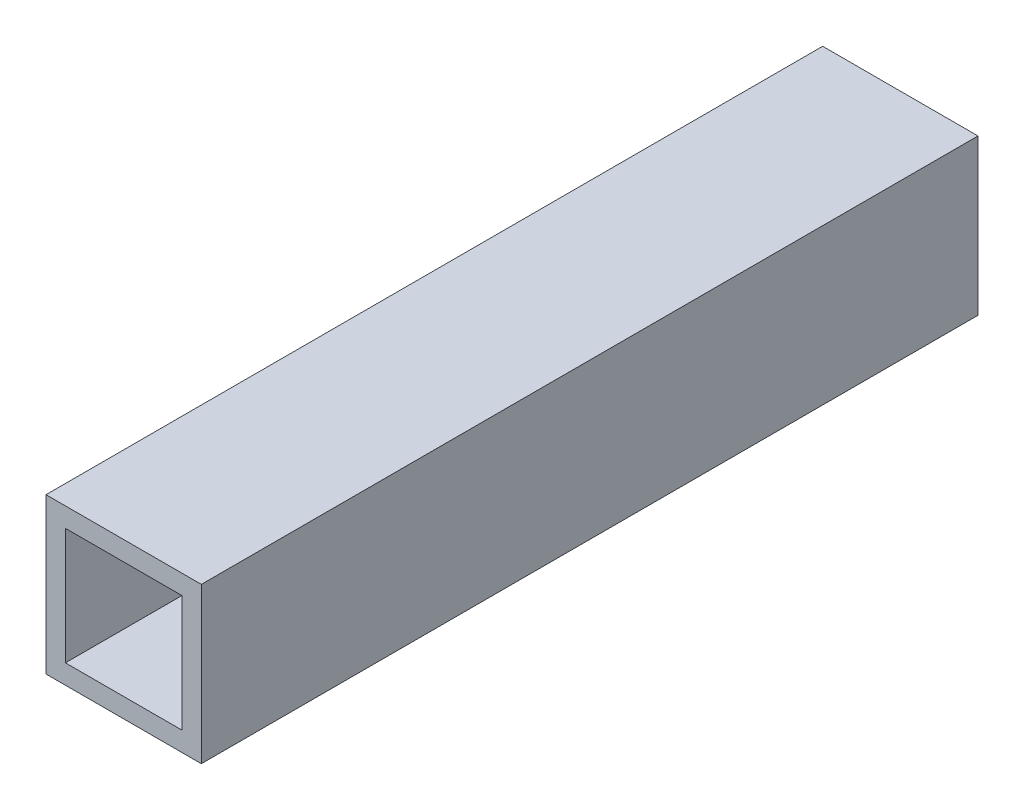
from build123d import *

# Parameters (mm, degrees)
SKETCH1_W           = 25.4
SKETCH1_H           = 25.4
BOSS_EXTRUDE1_DEPTH = 127
SKETCH2_W           = 19.05
SKETCH2_H           = 19.05
CUT_EXTRUDE1_DEPTH  = 132.982271537


with BuildPart() as part:
    # Sketch1 → Boss-Extrude1 (new body)
    with BuildSketch(Plane.XY):
        with Locations((-12.7, 12.7)):
            Rectangle(SKETCH1_W, SKETCH1_H)
    extrude(amount=BOSS_EXTRUDE1_DEPTH)

    # Sketch2 → Cut-Extrude1 (cut, through all)
    with BuildSketch(Plane.XY.offset(127)):
        with Locations((-12.7, 12.7)):
            Rectangle(SKETCH2_W, SKETCH2_H)
    extrude(amount=-CUT_EXTRUDE1_DEPTH, mode=Mode.SUBTRACT)


solid = part.part
